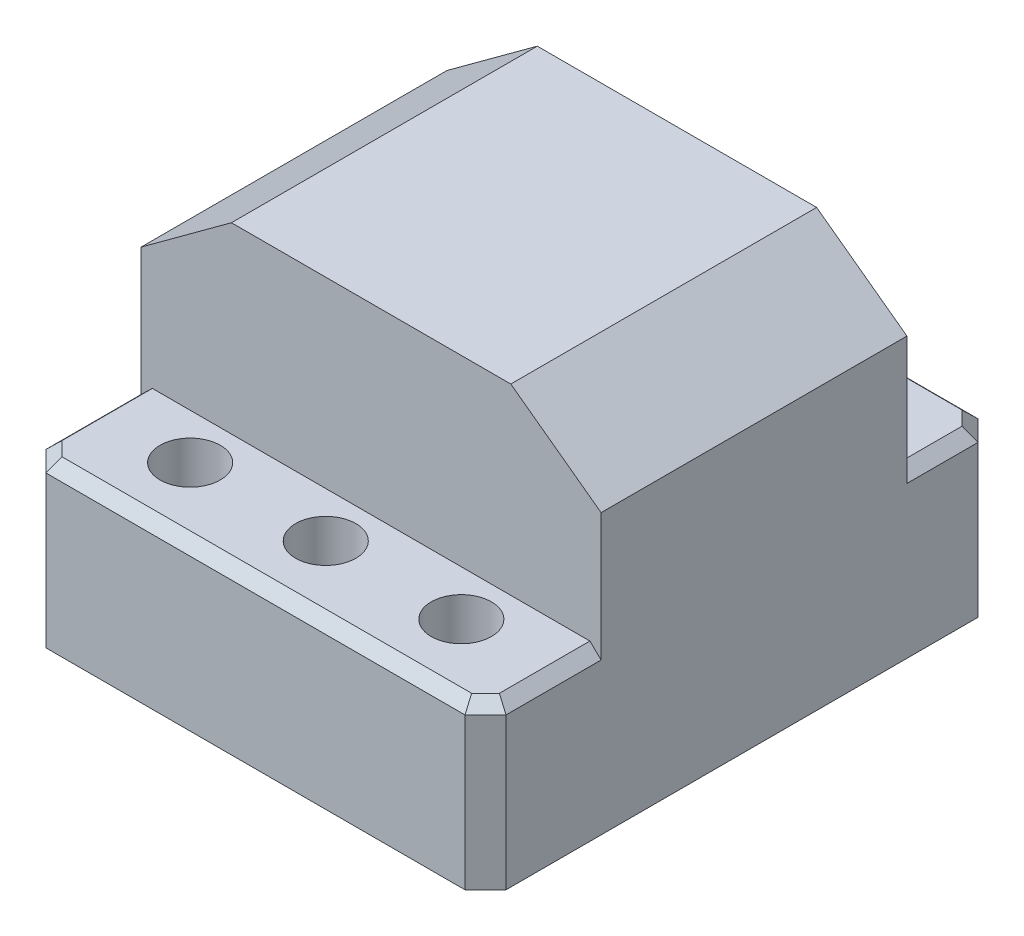
from build123d import *
from OCP.BRepFilletAPI import BRepFilletAPI_MakeChamfer

# Parameters (mm, degrees)
SKETCH1_W           = 48.514
SKETCH1_H           = 54.102
BOSS_EXTRUDE1_DEPTH = 17.1196
SKETCH3_W           = 48.514
SKETCH3_H           = 32.258
BOSS_EXTRUDE3_DEPTH = 19.304
CHAMFER1_SIZE       = 6.985
CHAMFER1_SIZE2      = 9.525
CHAMFER3_SIZE       = 2.159
CHAMFER4_SIZE       = 1.143
CHAMFER4_SIZE2      = 1.183611149
SKETCH4_R           = 3.175
CUT_EXTRUDE1_DEPTH  = 5.08
LPATTERN1_COUNT     = 2
LPATTERN1_PITCH     = 14.3002
LPATTERN1_COL_COUNT = 2
LPATTERN1_COL_PITCH = 14.3002


with BuildPart() as part:
    # Sketch1 → Boss-Extrude1 (new body)
    with BuildSketch(Plane(origin=(0, 0, 0), x_dir=(1, 0, 0), z_dir=(0, 1, 0))):
        with Locations((24.257, -27.051)):
            Rectangle(SKETCH1_W, SKETCH1_H)
    extrude(amount=BOSS_EXTRUDE1_DEPTH)

    # Sketch3 → Boss-Extrude3 (add)
    with BuildSketch(Plane(origin=(0, 17.1196, 0), x_dir=(1, 0, 0), z_dir=(0, 1, 0))):
        with Locations((24.257, -25.781)):
            Rectangle(SKETCH3_W, SKETCH3_H)
    extrude(amount=BOSS_EXTRUDE3_DEPTH)

    # Chamfer1: one chamfer whose edges measure the first distance from different faces: ONE call of the kernel's chamfer builder (chamfer() names one face for all edges)
    chamfer1_edges_1 = [part.edges().sort_by_distance(p)[0] for p in [
        (0, 36.4236, 25.781),
    ]]
    chamfer1_side_1 = [part.faces().sort_by_distance(p)[0] for p in [
        (0, 15.881477327, 26.540422781),
    ]]
    chamfer1_edges_2 = [part.edges().sort_by_distance(p)[0] for p in [
        (48.514, 36.4236, 25.781),
    ]]
    chamfer1_side_2 = [part.faces().sort_by_distance(p)[0] for p in [
        (48.514, 15.881477327, 26.540422781),
    ]]
    chamfer1 = BRepFilletAPI_MakeChamfer(part.part.solid().wrapped)
    for e in chamfer1_edges_1:
        chamfer1.Add(CHAMFER1_SIZE, CHAMFER1_SIZE2, e.wrapped, chamfer1_side_1[0].wrapped)  # the first distance lies on this face
    for e in chamfer1_edges_2:
        chamfer1.Add(CHAMFER1_SIZE, CHAMFER1_SIZE2, e.wrapped, chamfer1_side_2[0].wrapped)  # the first distance lies on this face
    add(Compound.cast(chamfer1.Shape()), mode=Mode.REPLACE)

    # Chamfer3
    chamfer3_edges = [part.edges().sort_by_distance(p)[0] for p in [
        (0, 8.5598, 0),
        (48.514, 8.5598, 0),
        (48.514, 8.5598, 54.102),
        (0, 8.5598, 54.102),
    ]]
    chamfer(chamfer3_edges, length=CHAMFER3_SIZE)

    # Chamfer4: one chamfer whose edges measure the first distance from different faces: ONE call of the kernel's chamfer builder (chamfer() names one face for all edges)
    chamfer4_edges_1 = [part.edges().sort_by_distance(p)[0] for p in [
        (0, 17.1196, 46.9265),
        (0, 17.1196, 5.9055),
    ]]
    chamfer4_side_1 = [part.faces().sort_by_distance(p)[0] for p in [
        (0, 13.24043998, 26.647148406),
    ]]
    chamfer4_edges_2 = [part.edges().sort_by_distance(p)[0] for p in [
        (48.514, 17.1196, 5.9055),
        (48.514, 17.1196, 46.9265),
    ]]
    chamfer4_side_2 = [part.faces().sort_by_distance(p)[0] for p in [
        (48.514, 13.24043998, 26.647148406),
    ]]
    chamfer4_edges_3 = [part.edges().sort_by_distance(p)[0] for p in [
        (24.257, 17.1196, 0),
    ]]
    chamfer4_side_3 = [part.faces().sort_by_distance(p)[0] for p in [
        (24.257, 8.5598, 0),
    ]]
    chamfer4_edges_4 = [part.edges().sort_by_distance(p)[0] for p in [
        (47.4345, 17.1196, 1.0795),
    ]]
    chamfer4_side_4 = [part.faces().sort_by_distance(p)[0] for p in [
        (47.4345, 8.5598, 1.0795),
    ]]
    chamfer4_edges_5 = [part.edges().sort_by_distance(p)[0] for p in [
        (1.0795, 17.1196, 1.0795),
    ]]
    chamfer4_side_5 = [part.faces().sort_by_distance(p)[0] for p in [
        (1.0795, 8.5598, 1.0795),
    ]]
    chamfer4_edges_6 = [part.edges().sort_by_distance(p)[0] for p in [
        (24.257, 17.1196, 54.102),
    ]]
    chamfer4_side_6 = [part.faces().sort_by_distance(p)[0] for p in [
        (24.257, 8.5598, 54.102),
    ]]
    chamfer4_edges_7 = [part.edges().sort_by_distance(p)[0] for p in [
        (1.0795, 17.1196, 53.0225),
    ]]
    chamfer4_side_7 = [part.faces().sort_by_distance(p)[0] for p in [
        (1.0795, 8.5598, 53.0225),
    ]]
    chamfer4_edges_8 = [part.edges().sort_by_distance(p)[0] for p in [
        (47.4345, 17.1196, 53.0225),
    ]]
    chamfer4_side_8 = [part.faces().sort_by_distance(p)[0] for p in [
        (47.4345, 8.5598, 53.0225),
    ]]
    chamfer4 = BRepFilletAPI_MakeChamfer(part.part.solid().wrapped)
    for e in chamfer4_edges_1:
        chamfer4.Add(CHAMFER4_SIZE, CHAMFER4_SIZE2, e.wrapped, chamfer4_side_1[0].wrapped)  # the first distance lies on this face
    for e in chamfer4_edges_2:
        chamfer4.Add(CHAMFER4_SIZE, CHAMFER4_SIZE2, e.wrapped, chamfer4_side_2[0].wrapped)  # the first distance lies on this face
    for e in chamfer4_edges_3:
        chamfer4.Add(CHAMFER4_SIZE, CHAMFER4_SIZE2, e.wrapped, chamfer4_side_3[0].wrapped)  # the first distance lies on this face
    for e in chamfer4_edges_4:
        chamfer4.Add(CHAMFER4_SIZE, CHAMFER4_SIZE2, e.wrapped, chamfer4_side_4[0].wrapped)  # the first distance lies on this face
    for e in chamfer4_edges_5:
        chamfer4.Add(CHAMFER4_SIZE, CHAMFER4_SIZE2, e.wrapped, chamfer4_side_5[0].wrapped)  # the first distance lies on this face
    for e in chamfer4_edges_6:
        chamfer4.Add(CHAMFER4_SIZE, CHAMFER4_SIZE2, e.wrapped, chamfer4_side_6[0].wrapped)  # the first distance lies on this face
    for e in chamfer4_edges_7:
        chamfer4.Add(CHAMFER4_SIZE, CHAMFER4_SIZE2, e.wrapped, chamfer4_side_7[0].wrapped)  # the first distance lies on this face
    for e in chamfer4_edges_8:
        chamfer4.Add(CHAMFER4_SIZE, CHAMFER4_SIZE2, e.wrapped, chamfer4_side_8[0].wrapped)  # the first distance lies on this face
    add(Compound.cast(chamfer4.Shape()), mode=Mode.REPLACE)

    # Sketch4 → Cut-Extrude1 (cut)
    with BuildSketch(Plane(origin=(0, 17.1196, 0), x_dir=(1, 0, 0), z_dir=(0, 1, 0))):
        with Locations(Location((24.257, -46.695388851, 0), (0, 0, 270))):
            Circle(SKETCH4_R)
    cut_extrude1 = extrude(amount=-CUT_EXTRUDE1_DEPTH, mode=Mode.SUBTRACT)

    # LPattern1: Cut-Extrude1 ×2
    with Locations(*[(i * LPATTERN1_PITCH, 0, 0) for i in range(1, LPATTERN1_COUNT)]):
        add(cut_extrude1, mode=Mode.SUBTRACT)

    # LPattern1 col: Cut-Extrude1 ×2
    with Locations(*[(-i * LPATTERN1_COL_PITCH, 0, 0) for i in range(1, LPATTERN1_COL_COUNT)]):
        add(cut_extrude1, mode=Mode.SUBTRACT)


solid = part.part
